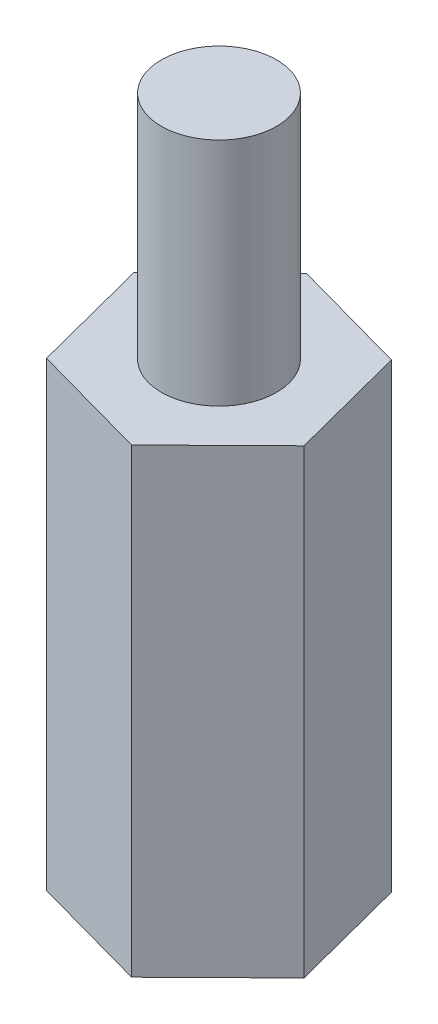
from build123d import *

# Parameters (mm, degrees)
BOSS_EXTRUDE1_DEPTH = 12
SKETCH2_R           = 1.5
BOSS_EXTRUDE2_DEPTH = 6
SKETCH3_R           = 1.5
CUT_EXTRUDE2_DEPTH  = 6


with BuildPart() as part:
    # Sketch1 → Boss-Extrude1 (new body)
    with BuildSketch(Plane(origin=(0, 0, 0), x_dir=(1, 0, 0), z_dir=(0, 1, 0))):
        Polygon((0.797220119, -3.073723054), (3.060532309, -0.846448652), (2.26331219, 2.227274402), (-0.797220119, 3.073723054), (-3.060532309, 0.846448652), (-2.26331219, -2.227274402), align=None)
    extrude(amount=BOSS_EXTRUDE1_DEPTH)

    # Sketch2 → Boss-Extrude2 (add)
    with BuildSketch(Plane(origin=(0, 12, 0), x_dir=(1, 0, 0), z_dir=(0, 1, 0))):
        with Locations(Location((0, 0, 0), (0, 0, 270))):
            Circle(SKETCH2_R)
    extrude(amount=BOSS_EXTRUDE2_DEPTH)

    # Sketch3 → Cut-Extrude2 (cut)
    with BuildSketch(Plane.XZ):
        with Locations(Location((0, 0, 0), (0, 0, 90))):
            Circle(SKETCH3_R)
    extrude(amount=-CUT_EXTRUDE2_DEPTH, mode=Mode.SUBTRACT)


solid = part.part
